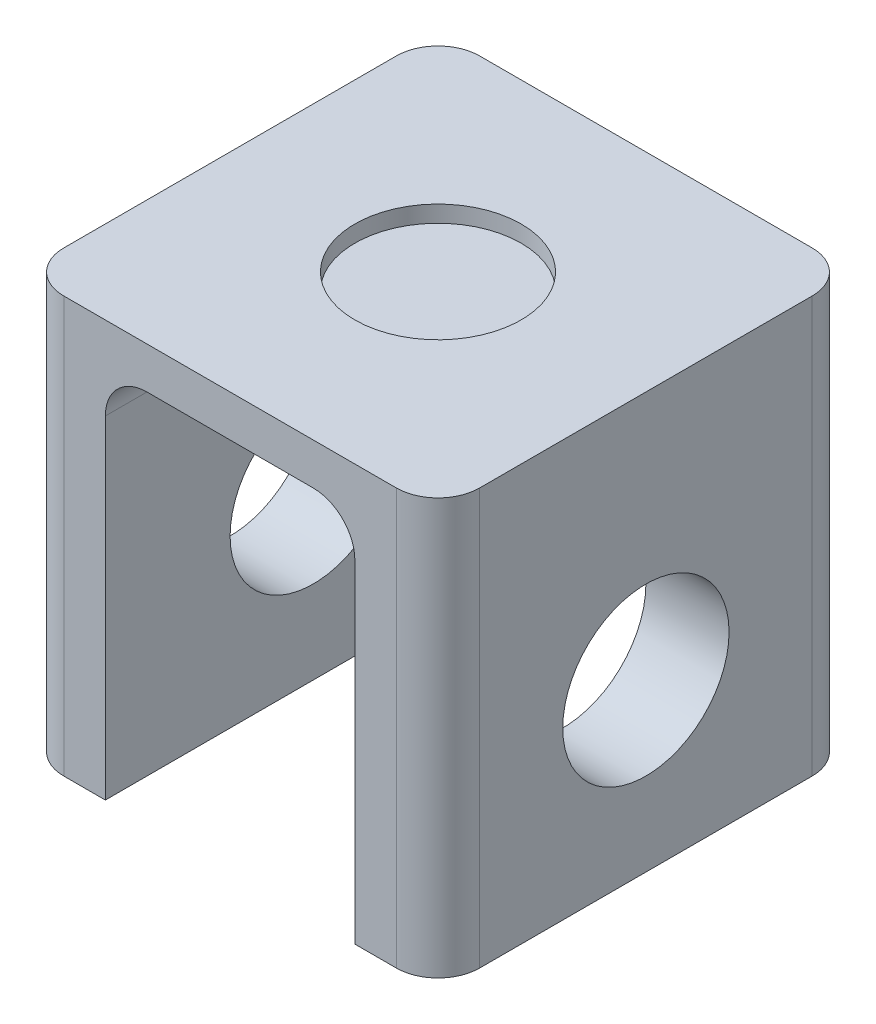
from build123d import *

# Parameters (mm, degrees)
SKETCH1_W           = 100
SKETCH1_H           = 100
BOSS_EXTRUDE1_DEPTH = 100
SKETCH2_R           = 20
CUT_EXTRUDE1_DEPTH  = 4
SKETCH3_W           = 60
SKETCH3_H           = 100
CUT_EXTRUDE2_DEPTH  = 90
SKETCH4_R           = 20
CUT_EXTRUDE3_DEPTH  = 135
FILLET1_R           = 10
FILLET2_R           = 10


with BuildPart() as part:
    # Sketch1 → Boss-Extrude1 (new body)
    with BuildSketch(Plane(origin=(0, 0, 0), x_dir=(1, 0, 0), z_dir=(0, 1, 0))):
        Rectangle(SKETCH1_W, SKETCH1_H)
    extrude(amount=BOSS_EXTRUDE1_DEPTH)

    # Sketch2 → Cut-Extrude1 (cut)
    with BuildSketch(Plane(origin=(0, 100, 0), x_dir=(1, 0, 0), z_dir=(0, 1, 0))):
        with Locations(Location((0, 0, 0), (0, 0, 270))):
            Circle(SKETCH2_R)
    extrude(amount=-CUT_EXTRUDE1_DEPTH, mode=Mode.SUBTRACT)

    # Sketch3 → Cut-Extrude2 (cut)
    with BuildSketch(Plane.XZ):
        Rectangle(SKETCH3_W, SKETCH3_H)
    extrude(amount=-CUT_EXTRUDE2_DEPTH, mode=Mode.SUBTRACT)

    # Sketch4 → Cut-Extrude3 (cut)
    with BuildSketch(Plane.ZY.offset(50)):
        with Locations((0, 40)):
            Circle(SKETCH4_R)
    extrude(amount=-CUT_EXTRUDE3_DEPTH, mode=Mode.SUBTRACT)

    # Fillet1
    fillet1_edges = [part.edges().sort_by_distance(p)[0] for p in [
        (50, 50, 50),
        (-50, 50, 50),
        (-50, 50, -50),
        (50, 50, -50),
    ]]
    fillet(fillet1_edges, radius=FILLET1_R)

    # Fillet2
    fillet2_edges = [part.edges().sort_by_distance(p)[0] for p in [
        (30, 90, 0),
        (-30, 90, 0),
    ]]
    fillet(fillet2_edges, radius=FILLET2_R)


solid = part.part
